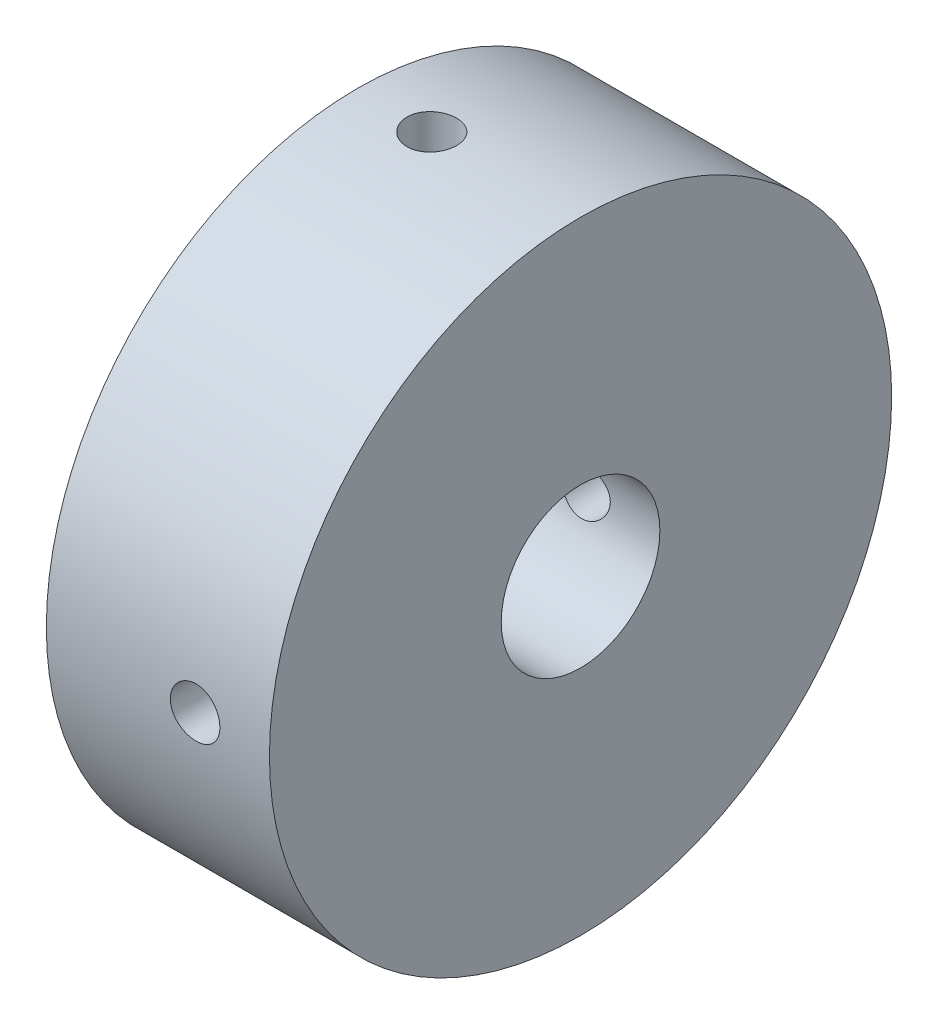
from build123d import *

# Parameters (mm, degrees)
SKETCH_1_R                      = 12.55
EXTRUDE_1_DEPTH                 = 9
CUT_EXTRUDE_1_REACH             = 21.9
SKETCH_2_R                      = 3.2
CUT_EXTRUDE_2_REACH             = 21.9
SKETCH_3_R                      = 1
CUT_EXTRUDE_2_DIRECTION_2_REACH = 21.9
CUT_EXTRUDE_3_DEPTH             = 21
CUT_EXTRUDE_3_DEPTH_BACK        = 19
SKETCH_4_R                      = 1


with BuildPart() as part:
    # 草图1 → 凸台-拉伸1 (new body)
    with BuildSketch(Plane(origin=(0, 0, 0), x_dir=(0, 0, -1), z_dir=(1, 0, 0))):
        Circle(SKETCH_1_R)
    extrude(amount=EXTRUDE_1_DEPTH)

    # 草图2 → 切除-拉伸1 (cut, up to next)
    with BuildSketch(Plane.ZY, mode=Mode.PRIVATE) as cut_extrude_1_sk1:
        Circle(SKETCH_2_R)
    cut_extrude_1_tool1 = extrude(cut_extrude_1_sk1.sketch, amount=-CUT_EXTRUDE_1_REACH, mode=Mode.PRIVATE) & part.part
    add(cut_extrude_1_tool1.solids().sort_by_distance((0, 0, 0))[0], mode=Mode.SUBTRACT)

    # 草图3 → 切除-拉伸2 (cut, up to next)
    with BuildSketch(Plane(origin=(0, 0, 0), x_dir=(1, 0, 0), z_dir=(0, 1, 0)), mode=Mode.PRIVATE) as cut_extrude_2_sk1:
        with Locations(Location((3, 0, 0), (0, 0, 270))):
            Circle(SKETCH_3_R)
    cut_extrude_2_tool1 = extrude(cut_extrude_2_sk1.sketch, amount=-CUT_EXTRUDE_2_REACH, mode=Mode.PRIVATE) & part.part
    add(cut_extrude_2_tool1.solids().sort_by_distance((3, 0, 0))[0], mode=Mode.SUBTRACT)

    # 草图3 → 切除-拉伸2 direction 2 (cut, up to next)
    with BuildSketch(Plane(origin=(0, 0, 0), x_dir=(1, 0, 0), z_dir=(0, 1, 0)), mode=Mode.PRIVATE) as cut_extrude_2_direction_2_sk1:
        with Locations(Location((3, 0, 0), (0, 0, 270))):
            Circle(SKETCH_3_R)
    cut_extrude_2_direction_2_tool1 = extrude(cut_extrude_2_direction_2_sk1.sketch, amount=CUT_EXTRUDE_2_DIRECTION_2_REACH, mode=Mode.PRIVATE) & part.part
    add(cut_extrude_2_direction_2_tool1.solids().sort_by_distance((3, 0, 0))[0], mode=Mode.SUBTRACT)

    # 草图4 → 切除-拉伸3 (cut, two sides: drawn at the far end of the back side and taken through both)
    with BuildSketch(Plane.XY.offset(-CUT_EXTRUDE_3_DEPTH_BACK)):
        with Locations(Location((6, 0, 0), (0, 0, 180))):
            Circle(SKETCH_4_R)
    extrude(amount=CUT_EXTRUDE_3_DEPTH + CUT_EXTRUDE_3_DEPTH_BACK, mode=Mode.SUBTRACT)


solid = part.part
